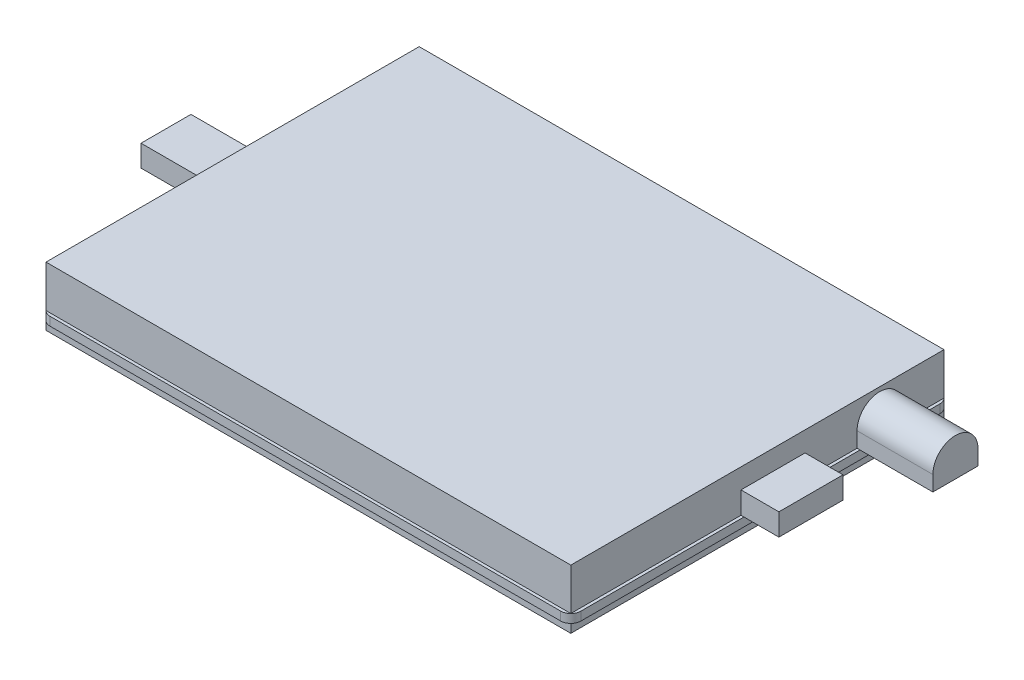
from build123d import *

# Parameters (mm, degrees)
FORMEPCB_DEPTH              = 1.7
ESQUISSE3_R                 = 2
PATERNTROUPCB_DEPTH         = 65.539832662
ESPACECOMPOSANTE_DEPTH      = 10
ESPACECOMPOSANTE_DEPTH_BACK = 1.7
ESQUISSE4_W                 = 103.828427124
ESQUISSE4_H                 = 73.828427124
ESQUISSE5_W                 = 12.674409656
ESQUISSE5_H                 = 4.344058099
ESPACESWITCH_DEPTH          = 7.5
ESPACEPOWER_DEPTH           = 15
ESQUISSE7_W                 = 9.880922925
ESQUISSE7_H                 = 4.269023058
ESPACEUSB_DEPTH             = 15


with BuildPart() as part:
    # Esquisse1 → FormePCB (new body)
    with BuildSketch(Plane(origin=(0, 0, 0), x_dir=(1, 0, 0), z_dir=(0, 1, 0))):
        with BuildLine():
            Line((-50.5, -37.5), (50.5, -37.5))
            ThreePointArc((50.5, -37.5), (51.914213562, -36.914213562), (52.5, -35.5))
            Line((52.5, -35.5), (52.5, 35.5))
            ThreePointArc((52.5, 35.5), (51.914213562, 36.914213562), (50.5, 37.5))
            Line((50.5, 37.5), (-50.5, 37.5))
            ThreePointArc((-50.5, 37.5), (-51.914213562, 36.914213562), (-52.5, 35.5))
            Line((-52.5, 35.5), (-52.5, -35.5))
            ThreePointArc((-52.5, -35.5), (-51.914213562, -36.914213562), (-50.5, -37.5))
        make_face()
    extrude(amount=FORMEPCB_DEPTH)

    # Esquisse3 → PaternTrouPCB (cut, through all)
    with BuildSketch(Plane(origin=(0, 0, 0), x_dir=(1, 0, 0), z_dir=(0, 1, 0))):
        with Locations(Location((48, 33, 0), (0, 0, 270))):
            Circle(ESQUISSE3_R)
        with Locations(Location((48, -33, 0), (0, 0, 90))):
            Circle(ESQUISSE3_R)
        with Locations(Location((-48, 33, 0), (0, 0, 90))):
            Circle(ESQUISSE3_R)
        with Locations(Location((-48, -33, 0), (0, 0, 270))):
            Circle(ESQUISSE3_R)
    extrude(amount=PATERNTROUPCB_DEPTH, mode=Mode.SUBTRACT)


with BuildPart() as body_2:
    # Esquisse4 → EspaceComposante (new, two sides: drawn at the far end of the back side and taken through both)
    with BuildSketch(Plane(origin=(0, 0, 0), x_dir=(1, 0, 0), z_dir=(0, 1, 0)).offset(-ESPACECOMPOSANTE_DEPTH_BACK)):
        Rectangle(ESQUISSE4_W, ESQUISSE4_H)
    extrude(amount=ESPACECOMPOSANTE_DEPTH + ESPACECOMPOSANTE_DEPTH_BACK)

    # Esquisse5 → EspaceSwitch (add)
    with BuildSketch(Plane(origin=(51.914213562, 0, 0), x_dir=(0, 0, -1), z_dir=(1, 0, 0))):
        with Locations((3.091310104, 3.87202905)):
            Rectangle(ESQUISSE5_W, ESQUISSE5_H)
    extrude(amount=ESPACESWITCH_DEPTH)

    # Esquisse6 → EspacePower (add)
    with BuildSketch(Plane(origin=(51.914213562, 0, 0), x_dir=(0, 0, -1), z_dir=(1, 0, 0))):
        with BuildLine():
            Line((19.71741504, 1.7), (28.643749067, 1.7))
            Line((28.643749067, 1.7), (28.643749067, 4.699337824))
            ThreePointArc((28.643749067, 4.699337824), (24.180582053, 9.162504837), (19.71741504, 4.699337824))
            Line((19.71741504, 4.699337824), (19.71741504, 1.7))
        make_face()
    extrude(amount=ESPACEPOWER_DEPTH)

    # Esquisse7 → EspaceUSB (add)
    with BuildSketch(Plane.ZY.offset(51.914213562)):
        with Locations((-1.824754593, 3.834511529)):
            Rectangle(ESQUISSE7_W, ESQUISSE7_H)
    extrude(amount=ESPACEUSB_DEPTH)


solid = Compound([part.part, body_2.part])
